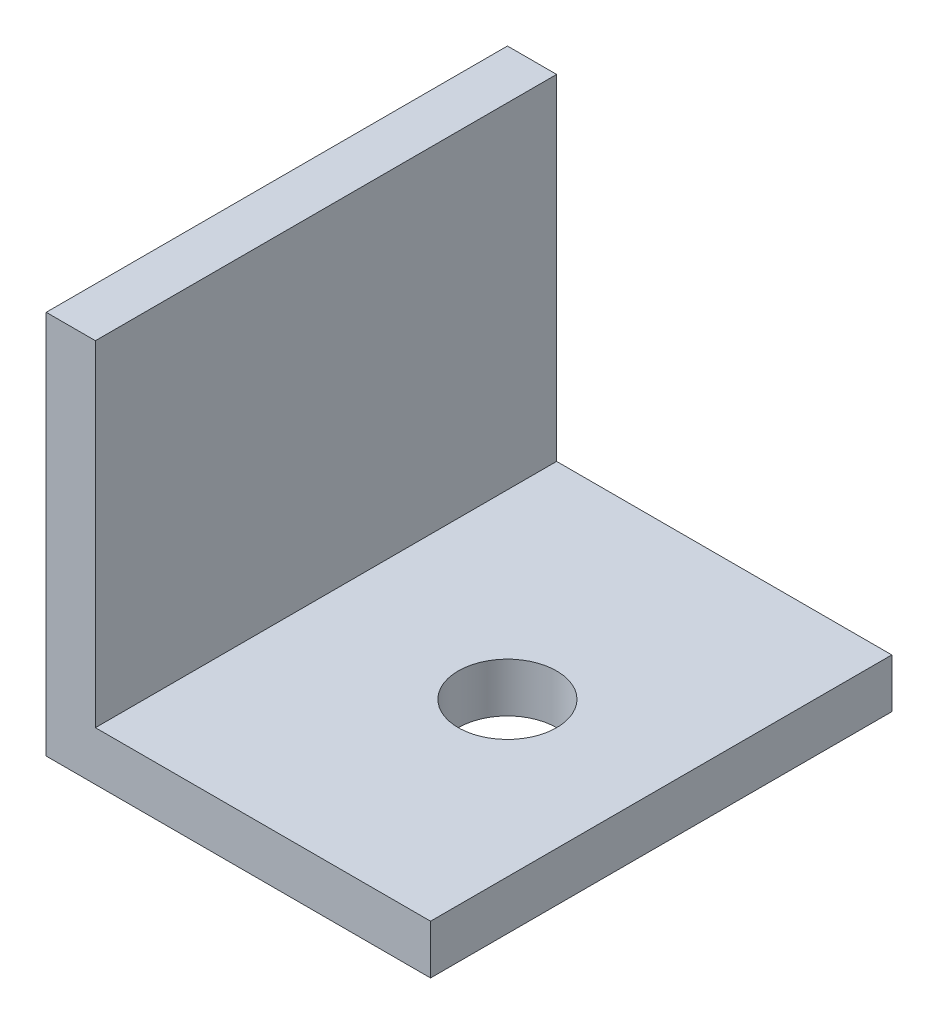
from build123d import *

# Parameters (mm, degrees)
BOSS_EXTRUDE1_DEPTH = 15
SKETCH2_R           = 1.6
CUT_EXTRUDE1_DEPTH  = 23.362021376


with BuildPart() as part:
    # Sketch1 → Boss-Extrude1 (new body)
    with BuildSketch(Plane.XY):
        Polygon((0, 0), (0, 12.5), (1.6, 12.5), (1.6, 1.6), (12.5, 1.6), (12.5, 0), align=None)
    extrude(amount=BOSS_EXTRUDE1_DEPTH)

    # Sketch2 → Cut-Extrude1 (cut, through all)
    with BuildSketch(Plane(origin=(0, 1.6, 0), x_dir=(1, 0, 0), z_dir=(0, 1, 0))):
        with Locations(Location((7.5, -7.5, 0), (0, 0, 180))):
            Circle(SKETCH2_R)
    extrude(amount=-CUT_EXTRUDE1_DEPTH, mode=Mode.SUBTRACT)


solid = part.part
